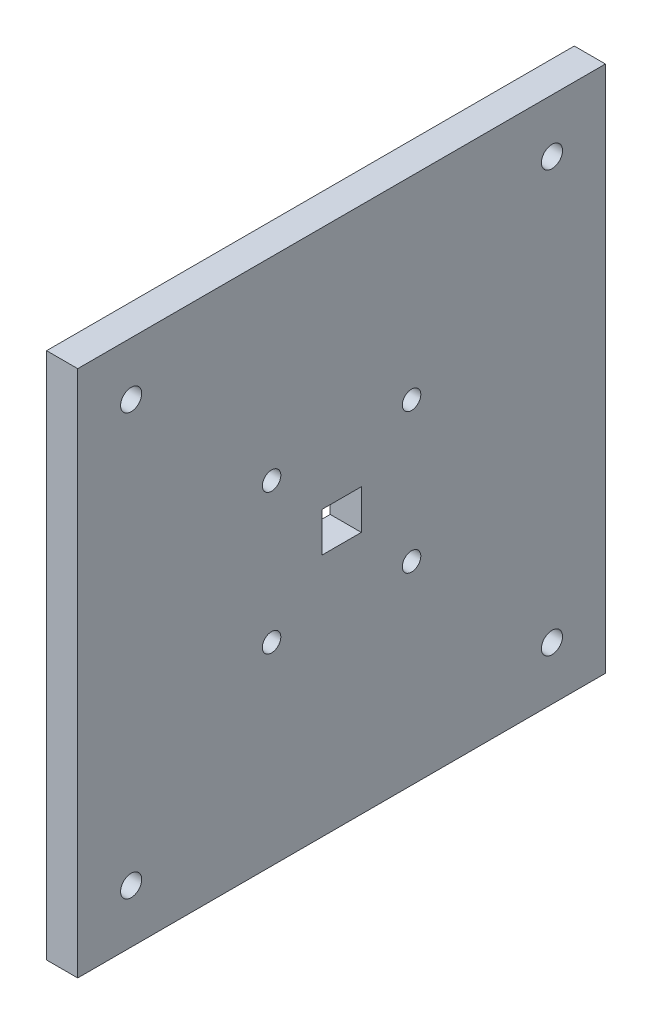
from build123d import *

# Parameters (mm, degrees)
SKETCH1_W           = 101.599999998
SKETCH1_H           = 101.6
SKETCH1_R           = 2.032
SKETCH1_R_2         = 1.778
SKETCH1_W_2         = 7.62
SKETCH1_H_2         = 7.62
BOSS_EXTRUDE1_DEPTH = 5.9944


with BuildPart() as part:
    # Sketch1 → Boss-Extrude1 (new body)
    with BuildSketch(Plane(origin=(0, 0, 0), x_dir=(0, 0, -1), z_dir=(1, 0, 0))):
        Rectangle(SKETCH1_W, SKETCH1_H)
        with Locations(Location((-40.513, 40.513, 0), (0, 0, 180))):
            Circle(SKETCH1_R, mode=Mode.SUBTRACT)
        with Locations(Location((40.513, 40.513, 0), (0, 0, 180))):
            Circle(SKETCH1_R, mode=Mode.SUBTRACT)
        with Locations(Location((40.513, -40.513, 0), (0, 0, 180))):
            Circle(SKETCH1_R, mode=Mode.SUBTRACT)
        with Locations(Location((-40.513, -40.513, 0), (0, 0, 180))):
            Circle(SKETCH1_R, mode=Mode.SUBTRACT)
        with Locations(Location((-13.4747, 13.4747, 0), (0, 0, 180))):
            Circle(SKETCH1_R_2, mode=Mode.SUBTRACT)
        with Locations(Location((-13.4747, -13.4747, 0), (0, 0, 180))):
            Circle(SKETCH1_R_2, mode=Mode.SUBTRACT)
        with Locations(Location((13.4747, -13.4747, 0), (0, 0, 180))):
            Circle(SKETCH1_R_2, mode=Mode.SUBTRACT)
        with Locations(Location((13.4747, 13.4747, 0), (0, 0, 180))):
            Circle(SKETCH1_R_2, mode=Mode.SUBTRACT)
        with Locations((-0.004315818, 0.004315818)):
            Rectangle(SKETCH1_W_2, SKETCH1_H_2, mode=Mode.SUBTRACT)
    extrude(amount=BOSS_EXTRUDE1_DEPTH)


solid = part.part
